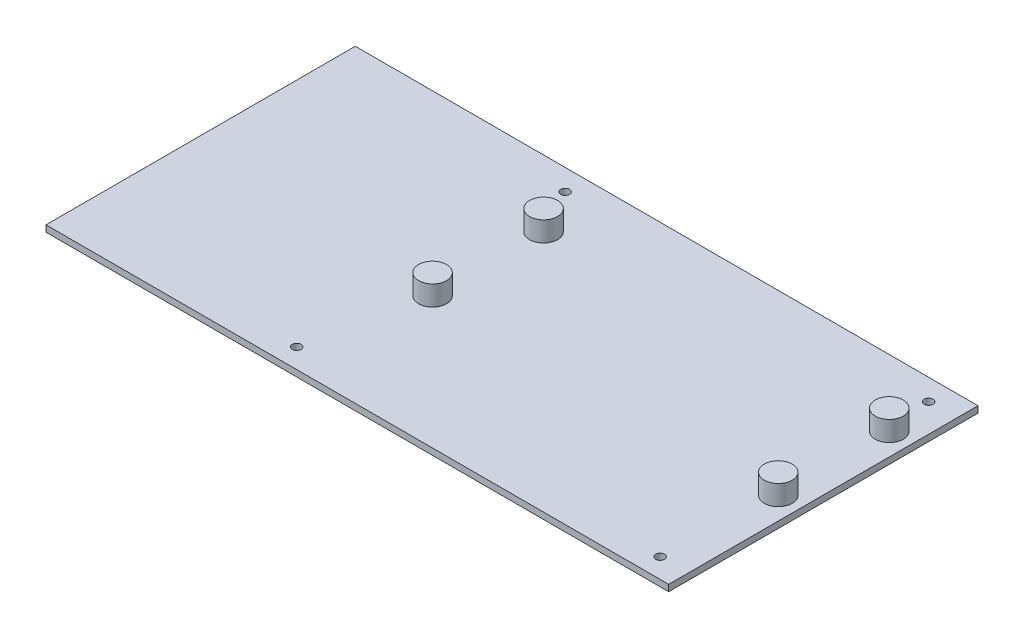
from build123d import *

# Parameters (mm, degrees)
SKETCH1_W            = 155
SKETCH1_H            = 77
BOSS_EXTRUDE1_DEPTH  = 1.6
SKETCH2_R            = 3.47579735
BOSS_EXTRUDE3_DEPTH  = 5
M2_CLEARANCE_HOLE1_D = 2.2


with BuildPart() as part:
    # Sketch1 → Boss-Extrude1 (new body)
    with BuildSketch(Plane(origin=(0, 0, 0), x_dir=(1, 0, 0), z_dir=(0, 1, 0))):
        with Locations((77.5, -38.5)):
            Rectangle(SKETCH1_W, SKETCH1_H)
    extrude(amount=BOSS_EXTRUDE1_DEPTH)

    # Sketch2 → Boss-Extrude3 (add)
    with BuildSketch(Plane(origin=(0, 1.6, 0), x_dir=(1, 0, 0), z_dir=(0, 1, 0))):
        with Locations(Location((63.398865642, -16.538313278, 0), (0, 0, 270))):
            Circle(SKETCH2_R)
        with Locations(Location((63.398865642, -44.168086722, 0), (0, 0, 270))):
            Circle(SKETCH2_R)
        with Locations(Location((149.449734358, -16.538313278, 0), (0, 0, 270))):
            Circle(SKETCH2_R)
        with Locations(Location((149.449734358, -44.168086722, 0), (0, 0, 270))):
            Circle(SKETCH2_R)
    extrude(amount=BOSS_EXTRUDE3_DEPTH)

    # M2 Clearance Hole1 (through all)
    with Locations(Plane(origin=(0, 1.6, 0), x_dir=(1, 0, 0), z_dir=(0, 1, 0))):
        with Locations((147.994644581, -5.281684189), (147.994644581, -72.114274551), (57.497596152, -72.114274551), (57.497596152, -5.281684189)):
            Hole(M2_CLEARANCE_HOLE1_D / 2)


solid = part.part
